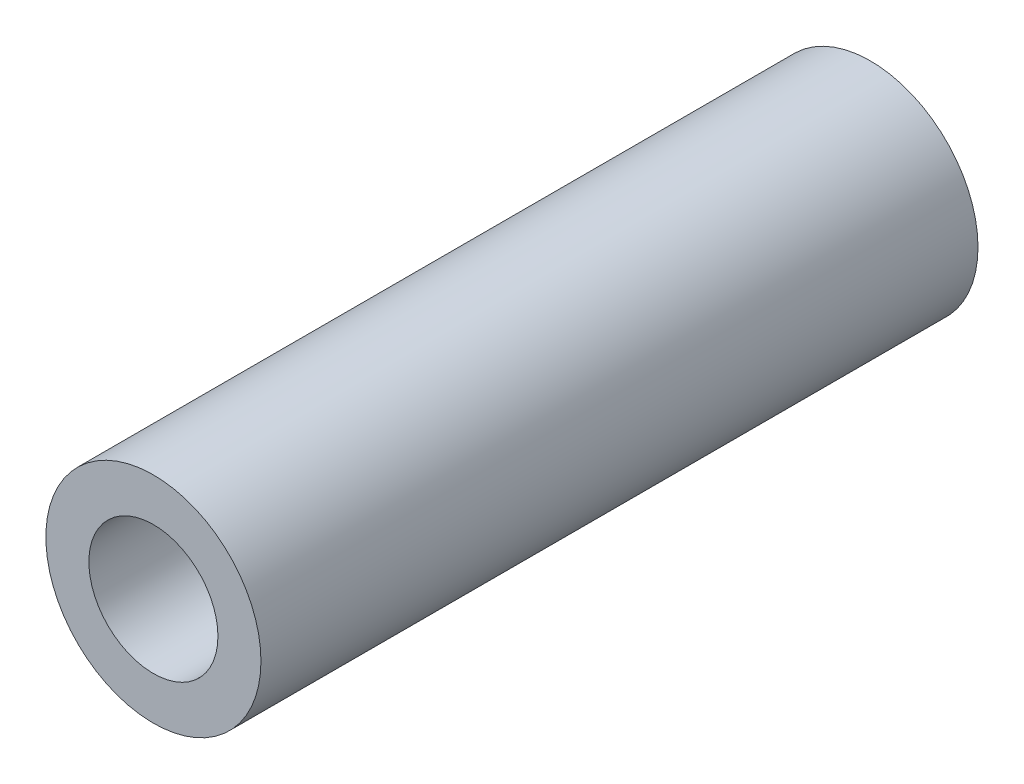
from build123d import *

# Parameters (mm, degrees)
SKETCH_1_R      = 7.5
SKETCH_1_R_2    = 4.5
EXTRUDE_1_DEPTH = 50


with BuildPart() as part:
    # 草图1 → 凸台-拉伸1 (new body)
    with BuildSketch(Plane.XY):
        Circle(SKETCH_1_R)
        Circle(SKETCH_1_R_2, mode=Mode.SUBTRACT)
    extrude(amount=EXTRUDE_1_DEPTH)


solid = part.part
